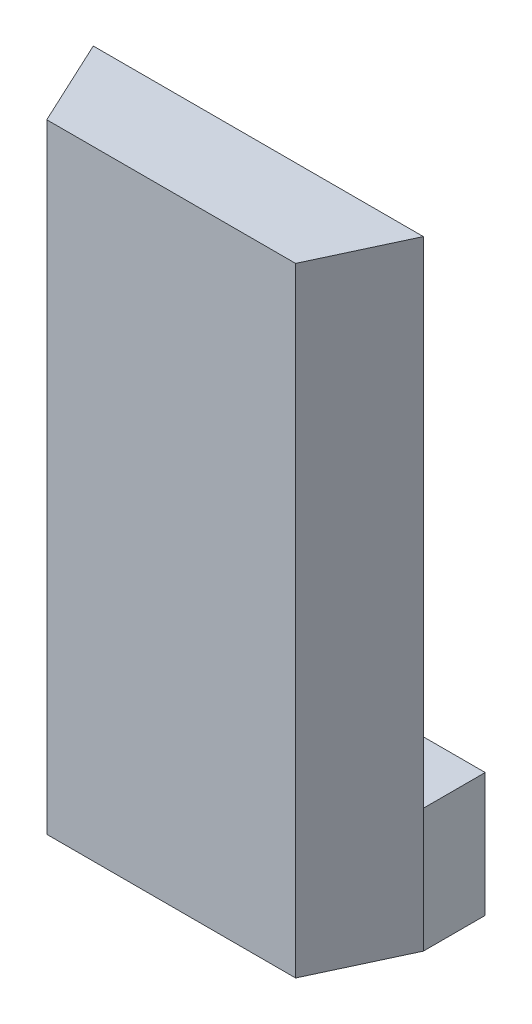
from build123d import *

# Parameters (mm, degrees)
CROQUIS1_W              = 8
CROQUIS1_H              = 1.5
SALIENTE_EXTRUIR4_DEPTH = 15
CROQUIS5_W              = 8
CROQUIS5_H              = 1.5
CORTAR_EXTRUIR3_DEPTH   = 12


with BuildPart() as part:
    # Croquis1 → Saliente-Extruir4 (new body)
    with BuildSketch(Plane(origin=(0, 0, 0), x_dir=(1, 0, 0), z_dir=(0, 1, 0))):
        with Locations((-4, -0.75)):
            Rectangle(CROQUIS1_W, CROQUIS1_H)
        Polygon((-7.015405321, -3.611470103), (-0.984594679, -3.611470103), (0, -1.5), (-8, -1.5), align=None)
    extrude(amount=SALIENTE_EXTRUIR4_DEPTH)

    # Croquis5 → Cortar-Extruir3 (cut)
    with BuildSketch(Plane(origin=(0, 15, 0), x_dir=(1, 0, 0), z_dir=(0, 1, 0))):
        with Locations((-4, -0.75)):
            Rectangle(CROQUIS5_W, CROQUIS5_H)
    extrude(amount=-CORTAR_EXTRUIR3_DEPTH, mode=Mode.SUBTRACT)


solid = part.part
